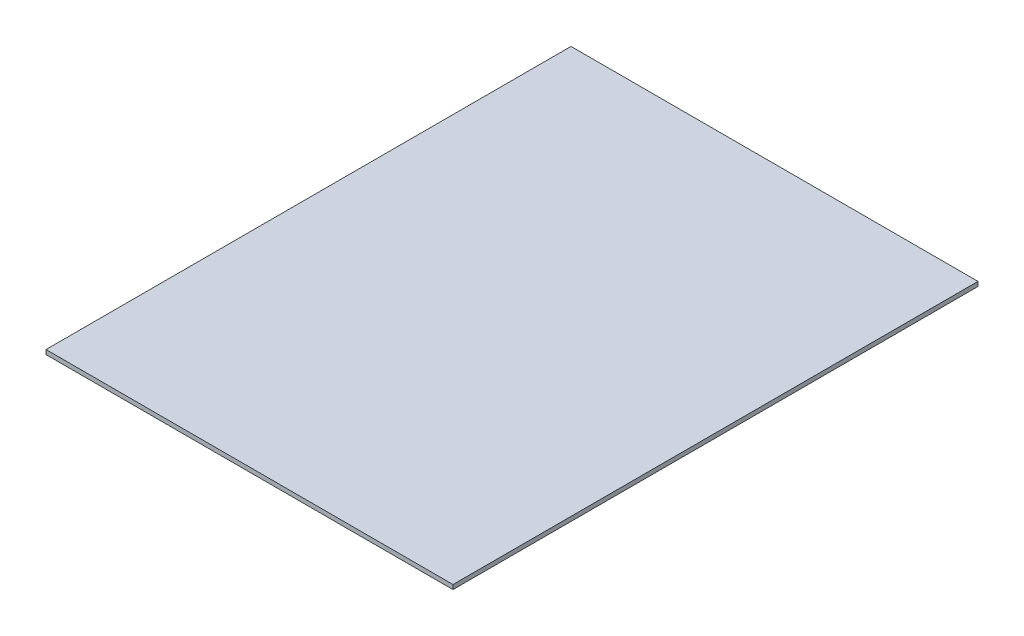
from build123d import *

# Parameters (mm, degrees)
SKETCH1_W           = 585.7875
SKETCH1_H           = 755.65
BOSS_EXTRUDE1_DEPTH = 6.35


with BuildPart() as part:
    # Sketch1 → Boss-Extrude1 (new body)
    with BuildSketch(Plane(origin=(0, 0, 0), x_dir=(1, 0, 0), z_dir=(0, 1, 0))):
        Rectangle(SKETCH1_W, SKETCH1_H)
    extrude(amount=BOSS_EXTRUDE1_DEPTH)


solid = part.part
